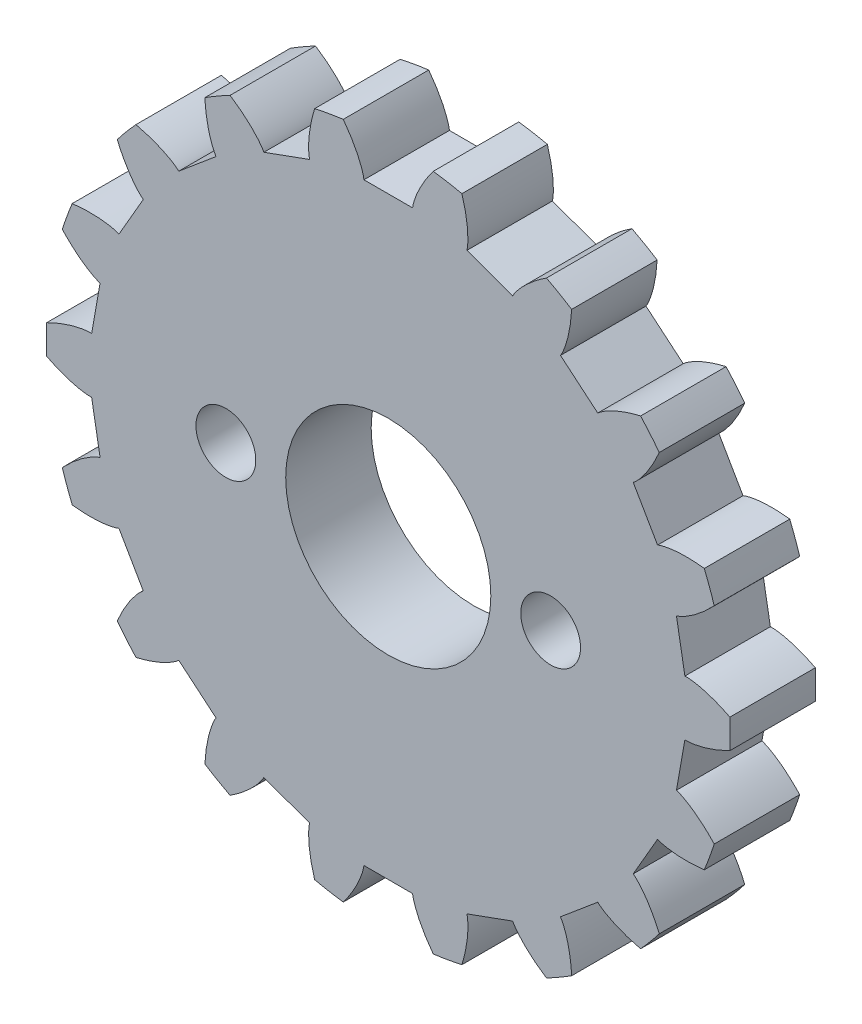
from build123d import *

# Parameters (mm, degrees)
SKETCH1_W               = 20
SKETCH1_H               = 5
CUT_EXTRUDE2_DEPTH      = 6
CIRPATTERN1_COUNT       = 18
CUT_EXTRUDE4_DEPTH      = 7
CUT_EXTRUDE4_DEPTH_BACK = 7
SKETCH3_R               = 6
SKETCH3_R_2             = 1.75


with BuildPart() as part:
    # Sketch1 → Revolve1 (revolve)
    with BuildSketch(Plane(origin=(0, 0, 0), x_dir=(1, 0, 0), z_dir=(0, 1, 0)), mode=Mode.PRIVATE) as revolve1_sk:
        with Locations((10, -2.5)):
            Rectangle(SKETCH1_W, SKETCH1_H)
    revolve(revolve1_sk.sketch.rotate(Axis((0, 0, 1), (0, 0, 1)), 180), axis=Axis((0, 0, 1), (0, 0, 1)))

    # Sketch2 → Cut-Extrude2 (cut, symmetric)
    with BuildSketch(Plane.XY):
        with BuildLine():
            add(Edge.make_bspline(
                [(17.351655252, 1.615069838), (17.355728073, 1.615400042), (17.367164056, 1.616175937), (17.388832903, 1.617049318), (17.424249609, 1.617630679), (17.469453629, 1.617130568), (17.527953339, 1.615058377), (17.596944484, 1.610782864), (17.672825272, 1.60416177), (17.755425477, 1.594883344), (17.837854393, 1.583791845), (17.920087039, 1.571019833), (18.001998309, 1.55675677), (18.101195436, 1.537660206), (18.220098078, 1.512232763), (18.358967282, 1.478830414), (18.516301695, 1.436604477), (18.676416113, 1.388931894), (18.833754182, 1.338213444), (18.992417806, 1.282598559), (19.145712895, 1.225691887), (19.304557696, 1.162118069), (19.450989469, 1.101164162), (19.614558254, 1.02794534), (19.746422348, 0.96741698), (19.882187746, 0.900791407), (19.948197318, 0.867759863), (19.981902714, 0.850624245)],
                knots=[3.8e-08, 3.8e-08, 3.8e-08, 3.8e-08, 3.8e-08, 0.005376749, 0.015083688, 0.02853182, 0.04661014, 0.064854849, 0.092110526, 0.119476176, 0.146842496, 0.174208854, 0.201574956, 0.228941013, 0.256307345, 0.307035032, 0.361767352, 0.416499661, 0.471231937, 0.525964282, 0.580696616, 0.635428982, 0.690161387, 0.744893688, 0.799626082, 0.854358407, 0.909090939, 0.909090939, 0.909090939, 0.909090939, 0.909090939], degree=4))
            add(Edge.make_bspline(
                [(19.981902714, 0.850624245), (20.456517287, 0.870828427), (21.393740476, 0.910725765), (23.849974777, 1.015286998), (25.571032415, 1.088551957), (28.169974217, 1.199188209), (30.227911533, 1.286794046), (32.562620683, 1.386181985), (34.725951769, 1.478274407), (36.811655324, 1.567062245), (38.614947071, 1.643827888), (40.353108281, 1.717820943), (42.012787616, 1.788473044), (43.749975557, 1.862424667), (45.53936531, 1.938598506), (47.288462752, 2.013057113), (49.005269954, 2.086141133), (50.685808453, 2.157681204), (52.495760695, 2.234730383), (54.061724174, 2.301393026), (55.894071965, 2.379395578), (57.194754565, 2.434765285), (58.887522028, 2.50682594), (59.541022443, 2.534645276), (59.945588429, 2.551867541)],
                knots=[0.083333333, 0.083333333, 0.083333333, 0.083333333, 0.083333333, 0.130837912, 0.181418842, 0.230855082, 0.273351648, 0.320856227, 0.369076236, 0.415364583, 0.460365156, 0.490842491, 0.521605998, 0.559333028, 0.599230197, 0.63578869, 0.670272436, 0.706437443, 0.740241529, 0.779733288, 0.814741682, 0.847842262, 0.876173306, 0.916666667, 0.916666667, 0.916666667, 0.916666667, 0.916666667], degree=4))
            add(Edge.make_bspline(
                [(59.945588429, 2.551867541), (59.938905529, 2.708854667), (59.924310791, 3.014548446), (59.884419367, 3.784499238), (59.840390783, 4.372806466), (59.775742098, 5.223167976), (59.708338498, 5.914697471), (59.627500908, 6.700665116), (59.539589409, 7.428048782), (59.440969283, 8.188733013), (59.333543539, 8.927864296), (59.216719225, 9.676814689), (59.090003431, 10.419161883), (58.955179634, 11.160079417), (58.80880246, 11.903818844), (58.656951851, 12.635116824), (58.489455127, 13.383656253), (58.323285048, 14.09724082), (58.130430768, 14.8634569), (57.957252417, 15.536335452), (57.727161544, 16.357525041), (57.567321958, 16.925411664), (57.341468954, 17.662572413), (57.250630092, 17.954822295), (57.203217205, 18.104627625)],
                knots=[0.083333333, 0.083333333, 0.083333333, 0.083333333, 0.083333333, 0.123015873, 0.162698413, 0.202380952, 0.242063492, 0.281746032, 0.321428571, 0.361111111, 0.400793651, 0.44047619, 0.48015873, 0.51984127, 0.55952381, 0.599206349, 0.638888889, 0.678571429, 0.718253968, 0.757936508, 0.797619048, 0.837301587, 0.876984127, 0.916666667, 0.916666667, 0.916666667, 0.916666667, 0.916666667], degree=4))
            add(Edge.make_bspline(
                [(57.203217205, 18.104627625), (56.910536106, 18.011995033), (56.319657649, 17.82498397), (54.890386173, 17.37262431), (53.799885477, 17.027484474), (52.207318099, 16.523442205), (50.713896955, 16.050779389), (48.895317658, 15.475205101), (47.13776305, 14.918944924), (45.189428594, 14.30230356), (43.422731107, 13.743149692), (41.584720939, 13.161425598), (39.694989725, 12.563331966), (37.801950234, 11.964191274), (35.869316319, 11.35251908), (33.834934173, 10.708643909), (31.95104968, 10.112400744), (29.757887016, 9.418272069), (27.788585628, 8.794994741), (25.114775454, 7.94874273), (23.255356987, 7.360242981), (20.622128403, 6.526834908), (19.60873591, 6.206099561), (19.067777207, 6.034887934)],
                knots=[0.083333333, 0.083333333, 0.083333333, 0.083333333, 0.083333333, 0.114032452, 0.147736378, 0.172793136, 0.205729167, 0.23839393, 0.287560096, 0.325270433, 0.36338141, 0.40627504, 0.443659856, 0.48455028, 0.529947917, 0.569928552, 0.615284455, 0.658128005, 0.701522436, 0.750450721, 0.806189904, 0.859925881, 0.916666667, 0.916666667, 0.916666667, 0.916666667, 0.916666667], degree=4))
            add(Edge.make_bspline(
                [(16.857608867, 4.416946438), (16.861549004, 4.418029135), (16.872560684, 4.421211369), (16.893221453, 4.427801841), (16.926701108, 4.439368767), (16.969007944, 4.455299404), (17.023270959, 4.477254705), (17.086639117, 4.504868734), (17.155679186, 4.537043285), (17.23012458, 4.574013088), (17.303788909, 4.612628038), (17.376694034, 4.652755024), (17.448787196, 4.694173223), (17.535470594, 4.746045539), (17.638505831, 4.810606619), (17.757575922, 4.889490625), (17.890979787, 4.982981564), (18.025133141, 5.082541495), (18.155635832, 5.184014037), (18.285709457, 5.29054109), (18.410296493, 5.396445877), (18.537818255, 5.510513847), (18.654571647, 5.617874399), (18.783233715, 5.742621405), (18.886443513, 5.844599634), (18.991233968, 5.953641695), (19.041965222, 6.007257796), (19.067777207, 6.034887934)],
                knots=[0, 0, 0, 0, 0, 0.005376749, 0.015083688, 0.02853182, 0.04661014, 0.064854849, 0.092110526, 0.119476176, 0.146842496, 0.174208854, 0.201574956, 0.228941013, 0.256307345, 0.307035032, 0.361767352, 0.416499661, 0.471231937, 0.525964282, 0.580696616, 0.635428982, 0.690161387, 0.744893688, 0.799626082, 0.854358407, 0.909090914, 0.909090914, 0.909090914, 0.909090914, 0.909090914], degree=4))
            add(Edge.make_bspline(
                [(16.857608867, 4.416946438), (16.862071247, 4.391639023), (16.871812599, 4.336393073), (16.895923809, 4.199651606), (16.914550105, 4.094016633), (16.941507645, 3.941132823), (16.962977993, 3.819368432), (16.987148393, 3.682291283), (17.009426274, 3.555947136), (17.032268156, 3.42640439), (17.054415738, 3.300799207), (17.076425465, 3.175975843), (17.098918688, 3.048410436), (17.120740549, 2.924652512), (17.143511026, 2.795514719), (17.166438, 2.665489391), (17.189306389, 2.535796309), (17.212913109, 2.401915946), (17.240068336, 2.247911002), (17.264501475, 2.109343785), (17.295013175, 1.936303337), (17.31546951, 1.820289695), (17.338482532, 1.689776361), (17.347484532, 1.638723483), (17.351655252, 1.615069838)],
                knots=[0.083333333, 0.083333333, 0.083333333, 0.083333333, 0.083333333, 0.119462569, 0.163604625, 0.204741873, 0.241371909, 0.28289072, 0.319568452, 0.360777244, 0.395976419, 0.434538118, 0.470381181, 0.508585165, 0.547933837, 0.582059867, 0.623197115, 0.664835165, 0.699461996, 0.745821886, 0.798763736, 0.843454289, 0.882898352, 0.916666667, 0.916666667, 0.916666667, 0.916666667, 0.916666667], degree=4))
        make_face()
    cut_extrude2 = extrude(amount=CUT_EXTRUDE2_DEPTH, both=True, mode=Mode.SUBTRACT)

    # CirPattern1: Cut-Extrude2 ×18 about axis
    cirpattern1_axis = Axis((0, 0, -0.25), (0, 0, 1))
    for i in range(1, CIRPATTERN1_COUNT):
        add(cut_extrude2.rotate(cirpattern1_axis, i * 360 / CIRPATTERN1_COUNT), mode=Mode.SUBTRACT)

    # Sketch3 → Cut-Extrude4 (cut, two sides: drawn at the far end of the back side and taken through both)
    with BuildSketch(Plane.XY.offset(-CUT_EXTRUDE4_DEPTH_BACK)):
        with Locations(Location((0, 0, 0), (0, 0, 180))):
            Circle(SKETCH3_R)
        with Locations(Location((9.5, 0, 0), (0, 0, 180))):
            Circle(SKETCH3_R_2)
        with Locations(Location((-9.5, 0, 0), (0, 0, 180))):
            Circle(SKETCH3_R_2)
    extrude(amount=CUT_EXTRUDE4_DEPTH + CUT_EXTRUDE4_DEPTH_BACK, mode=Mode.SUBTRACT)


solid = part.part
